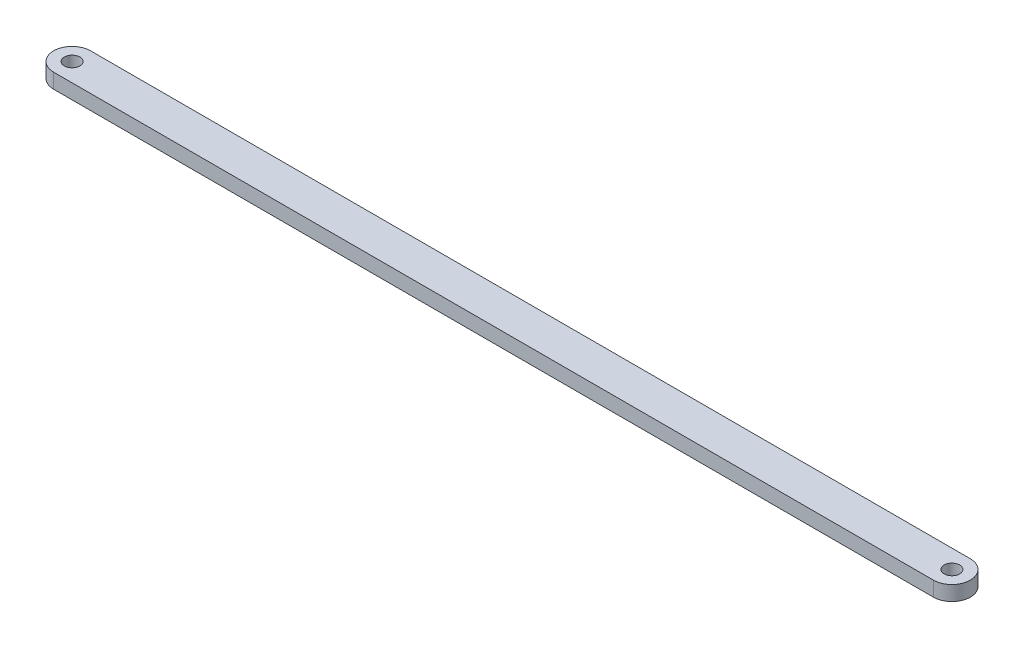
from build123d import *

# Parameters (mm, degrees)
SKETCH1_R           = 1.05
BOSS_EXTRUDE1_DEPTH = 2


with BuildPart() as part:
    # Sketch1 → Boss-Extrude1 (new body)
    with BuildSketch(Plane(origin=(0, 0, 0), x_dir=(1, 0, 0), z_dir=(0, 1, 0))):
        with BuildLine():
            Line((0, 2.5), (119, 2.5))
            ThreePointArc((119, 2.5), (121.5, 0), (119, -2.5))
            Line((119, -2.5), (0, -2.5))
            ThreePointArc((0, -2.5), (-2.5, 0), (0, 2.5))
        make_face()
        with Locations(Location((0, 0, 0), (0, 0, 270))):
            Circle(SKETCH1_R, mode=Mode.SUBTRACT)
        with Locations(Location((119, 0, 0), (0, 0, 270))):
            Circle(SKETCH1_R, mode=Mode.SUBTRACT)
    extrude(amount=BOSS_EXTRUDE1_DEPTH)


solid = part.part
